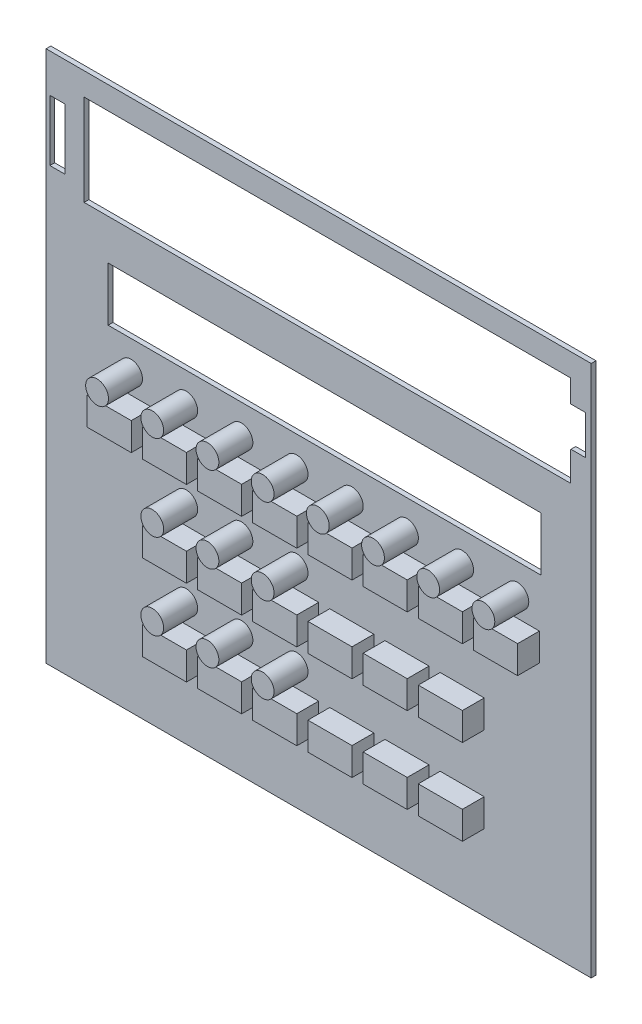
from build123d import *

# Parameters (mm, degrees)
SKETCH1_W                       = 182.118
SKETCH1_H                       = 177.8
SKETCH1_W_2                     = 144.56156
SKETCH1_H_2                     = 18.00098
SKETCH1_W_3                     = 5.08
SKETCH1_H_3                     = 20.32
BOARD_DEPTH                     = 1.592072
SKETCH2_R                       = 3.81
LED_KINGBRIGHT_3P_2P54_1_DEPTH  = 11.3538
SKETCH3_R                       = 3.81
LED_KINGBRIGHT_3P_2P54_2_DEPTH  = 11.3538
SKETCH4_R                       = 3.81
LED_KINGBRIGHT_3P_2P54_3_DEPTH  = 11.3538
SKETCH6_R                       = 3.81
LED_KINGBRIGHT_3P_2P54_5_DEPTH  = 11.3538
SKETCH7_R                       = 3.81
LED_KINGBRIGHT_3P_2P54_6_DEPTH  = 11.3538
SKETCH8_R                       = 3.81
LED_KINGBRIGHT_3P_2P54_7_DEPTH  = 11.3538
SKETCH10_R                      = 3.81
LED_KINGBRIGHT_3P_2P54_9_DEPTH  = 11.3538
SKETCH11_R                      = 3.81
LED_KINGBRIGHT_3P_2P54_10_DEPTH = 11.3538
SKETCH12_R                      = 3.81
LED_KINGBRIGHT_3P_2P54_11_DEPTH = 11.3538
SKETCH13_R                      = 3.81
LED_KINGBRIGHT_3P_2P54_12_DEPTH = 11.3538
SKETCH14_R                      = 3.81
LED_KINGBRIGHT_3P_2P54_13_DEPTH = 11.3538
SKETCH15_R                      = 3.81
LED_KINGBRIGHT_3P_2P54_14_DEPTH = 11.3538
SKETCH16_R                      = 3.81
LED_KINGBRIGHT_3P_2P54_15_DEPTH = 11.3538
SKETCH17_R                      = 3.81
LED_KINGBRIGHT_3P_2P54_16_DEPTH = 11.3538
SKETCH18_W                      = 14.732
SKETCH18_H                      = 9.271
SWITCH_MCDTS2_1_DEPTH           = 7.3000108
SKETCH19_W                      = 14.732
SKETCH19_H                      = 9.271
SWITCH_MCDTS2_2_DEPTH           = 7.3000108
SKETCH20_W                      = 14.732
SKETCH20_H                      = 9.271
SWITCH_MCDTS2_3_DEPTH           = 7.3000108
SKETCH21_W                      = 14.732
SKETCH21_H                      = 9.271
SWITCH_MCDTS2_4_DEPTH           = 7.3000108
SKETCH22_W                      = 14.732
SKETCH22_H                      = 9.271
SWITCH_MCDTS2_5_DEPTH           = 7.3000108
SKETCH23_W                      = 14.732
SKETCH23_H                      = 9.271
SWITCH_MCDTS2_6_DEPTH           = 7.3000108
SKETCH25_W                      = 14.732
SKETCH25_H                      = 9.271
SWITCH_MCDTS2_8_DEPTH           = 7.3000108
SKETCH26_W                      = 14.732
SKETCH26_H                      = 9.271
SWITCH_MCDTS2_9_DEPTH           = 7.3000108
SKETCH27_W                      = 14.732
SKETCH27_H                      = 9.271
SWITCH_MCDTS2_10_DEPTH          = 7.3000108
SKETCH28_W                      = 14.732
SKETCH28_H                      = 9.271
SWITCH_MCDTS2_11_DEPTH          = 7.3000108
SKETCH29_W                      = 14.732
SKETCH29_H                      = 9.271
SWITCH_MCDTS2_12_DEPTH          = 7.3000108
SKETCH30_W                      = 14.732
SKETCH30_H                      = 9.271
SWITCH_MCDTS2_13_DEPTH          = 7.3000108
SKETCH32_W                      = 14.732
SKETCH32_H                      = 9.271
SWITCH_MCDTS2_15_DEPTH          = 7.3000108
SKETCH33_W                      = 14.732
SKETCH33_H                      = 9.271
SWITCH_MCDTS2_16_DEPTH          = 7.3000108
SKETCH34_W                      = 14.732
SKETCH34_H                      = 9.271
SWITCH_MCDTS2_17_DEPTH          = 7.3000108
SKETCH35_W                      = 14.732
SKETCH35_H                      = 9.271
SWITCH_MCDTS2_18_DEPTH          = 7.3000108
SKETCH36_W                      = 14.732
SKETCH36_H                      = 9.271
SWITCH_MCDTS2_19_DEPTH          = 7.3000108
SKETCH37_W                      = 14.732
SKETCH37_H                      = 9.271
SWITCH_MCDTS2_20_DEPTH          = 7.3000108
SKETCH38_W                      = 14.732
SKETCH38_H                      = 9.271
SWITCH_MCDTS2_21_DEPTH          = 7.3000108
SKETCH39_W                      = 14.732
SKETCH39_H                      = 9.271
SWITCH_MCDTS2_22_DEPTH          = 7.3000108


with BuildPart() as part:
    # Sketch1 → BOARD (new body)
    with BuildSketch(Plane.XY):
        with Locations((91.059, 88.9)):
            Rectangle(SKETCH1_W, SKETCH1_H)
        with Locations((93.01988, 117.17909)):
            Rectangle(SKETCH1_W_2, SKETCH1_H_2, mode=Mode.SUBTRACT)
        with Locations((3.81, 154.813)):
            Rectangle(SKETCH1_W_3, SKETCH1_H_3, mode=Mode.SUBTRACT)
        Polygon((12.7, 139.7), (12.7, 170.18), (175.26, 170.18), (175.26, 162.6616), (180.086, 162.6616), (180.2892, 162.4584), (180.2892, 149.606), (175.3616, 149.606), (175.26, 149.5044), (175.26, 139.7), align=None, mode=Mode.SUBTRACT)
    extrude(amount=BOARD_DEPTH)


with BuildPart() as body_2:
    # Sketch2 → LED-KINGBRIGHT_3P_2P54-1 (new body)
    with BuildSketch(Plane.XY.offset(1.592072)):
        with Locations((83.7097132, 41.1988)):
            Circle(SKETCH2_R)
    extrude(amount=LED_KINGBRIGHT_3P_2P54_1_DEPTH)


with BuildPart() as body_3:
    # Sketch3 → LED-KINGBRIGHT_3P_2P54-2 (new body)
    with BuildSketch(Plane.XY.offset(1.592072)):
        with Locations((65.2722088, 41.1988)):
            Circle(SKETCH3_R)
    extrude(amount=LED_KINGBRIGHT_3P_2P54_2_DEPTH)


with BuildPart() as body_4:
    # Sketch4 → LED-KINGBRIGHT_3P_2P54-3 (new body)
    with BuildSketch(Plane.XY.offset(1.592072)):
        with Locations((46.8347044, 41.1988)):
            Circle(SKETCH4_R)
    extrude(amount=LED_KINGBRIGHT_3P_2P54_3_DEPTH)


with BuildPart() as body_5:
    # Sketch6 → LED-KINGBRIGHT_3P_2P54-5 (new body)
    with BuildSketch(Plane.XY.offset(1.592072)):
        with Locations((83.7097132, 69.7738)):
            Circle(SKETCH6_R)
    extrude(amount=LED_KINGBRIGHT_3P_2P54_5_DEPTH)


with BuildPart() as body_6:
    # Sketch7 → LED-KINGBRIGHT_3P_2P54-6 (new body)
    with BuildSketch(Plane.XY.offset(1.592072)):
        with Locations((65.2722088, 69.7738)):
            Circle(SKETCH7_R)
    extrude(amount=LED_KINGBRIGHT_3P_2P54_6_DEPTH)


with BuildPart() as body_7:
    # Sketch8 → LED-KINGBRIGHT_3P_2P54-7 (new body)
    with BuildSketch(Plane.XY.offset(1.592072)):
        with Locations((46.8347044, 69.7738)):
            Circle(SKETCH8_R)
    extrude(amount=LED_KINGBRIGHT_3P_2P54_7_DEPTH)


with BuildPart() as body_8:
    # Sketch10 → LED-KINGBRIGHT_3P_2P54-9 (new body)
    with BuildSketch(Plane.XY.offset(1.592072)):
        with Locations((157.4597308, 98.3488)):
            Circle(SKETCH10_R)
    extrude(amount=LED_KINGBRIGHT_3P_2P54_9_DEPTH)


with BuildPart() as body_9:
    # Sketch11 → LED-KINGBRIGHT_3P_2P54-10 (new body)
    with BuildSketch(Plane.XY.offset(1.592072)):
        with Locations((139.0222264, 98.3488)):
            Circle(SKETCH11_R)
    extrude(amount=LED_KINGBRIGHT_3P_2P54_10_DEPTH)


with BuildPart() as body_10:
    # Sketch12 → LED-KINGBRIGHT_3P_2P54-11 (new body)
    with BuildSketch(Plane.XY.offset(1.592072)):
        with Locations((120.584722, 98.3488)):
            Circle(SKETCH12_R)
    extrude(amount=LED_KINGBRIGHT_3P_2P54_11_DEPTH)


with BuildPart() as body_11:
    # Sketch13 → LED-KINGBRIGHT_3P_2P54-12 (new body)
    with BuildSketch(Plane.XY.offset(1.592072)):
        with Locations((102.1472176, 98.3488)):
            Circle(SKETCH13_R)
    extrude(amount=LED_KINGBRIGHT_3P_2P54_12_DEPTH)


with BuildPart() as body_12:
    # Sketch14 → LED-KINGBRIGHT_3P_2P54-13 (new body)
    with BuildSketch(Plane.XY.offset(1.592072)):
        with Locations((83.7097132, 98.3488)):
            Circle(SKETCH14_R)
    extrude(amount=LED_KINGBRIGHT_3P_2P54_13_DEPTH)


with BuildPart() as body_13:
    # Sketch15 → LED-KINGBRIGHT_3P_2P54-14 (new body)
    with BuildSketch(Plane.XY.offset(1.592072)):
        with Locations((65.2722088, 98.3488)):
            Circle(SKETCH15_R)
    extrude(amount=LED_KINGBRIGHT_3P_2P54_14_DEPTH)


with BuildPart() as body_14:
    # Sketch16 → LED-KINGBRIGHT_3P_2P54-15 (new body)
    with BuildSketch(Plane.XY.offset(1.592072)):
        with Locations((46.8347044, 98.3488)):
            Circle(SKETCH16_R)
    extrude(amount=LED_KINGBRIGHT_3P_2P54_15_DEPTH)


with BuildPart() as body_15:
    # Sketch17 → LED-KINGBRIGHT_3P_2P54-16 (new body)
    with BuildSketch(Plane.XY.offset(1.592072)):
        with Locations((28.3972, 98.3488)):
            Circle(SKETCH17_R)
    extrude(amount=LED_KINGBRIGHT_3P_2P54_16_DEPTH)


with BuildPart() as body_16:
    # Sketch18 → SWITCH-MCDTS2-1 (new body)
    with BuildSketch(Plane.XY.offset(1.592072)):
        with Locations((139.0222264, 29.9593)):
            Rectangle(SKETCH18_W, SKETCH18_H)
    extrude(amount=SWITCH_MCDTS2_1_DEPTH)


with BuildPart() as body_17:
    # Sketch19 → SWITCH-MCDTS2-2 (new body)
    with BuildSketch(Plane.XY.offset(1.592072)):
        with Locations((120.584722, 29.9593)):
            Rectangle(SKETCH19_W, SKETCH19_H)
    extrude(amount=SWITCH_MCDTS2_2_DEPTH)


with BuildPart() as body_18:
    # Sketch20 → SWITCH-MCDTS2-3 (new body)
    with BuildSketch(Plane.XY.offset(1.592072)):
        with Locations((102.1472176, 29.9593)):
            Rectangle(SKETCH20_W, SKETCH20_H)
    extrude(amount=SWITCH_MCDTS2_3_DEPTH)


with BuildPart() as body_19:
    # Sketch21 → SWITCH-MCDTS2-4 (new body)
    with BuildSketch(Plane.XY.offset(1.592072)):
        with Locations((83.7097132, 29.9593)):
            Rectangle(SKETCH21_W, SKETCH21_H)
    extrude(amount=SWITCH_MCDTS2_4_DEPTH)


with BuildPart() as body_20:
    # Sketch22 → SWITCH-MCDTS2-5 (new body)
    with BuildSketch(Plane.XY.offset(1.592072)):
        with Locations((65.2722088, 29.9593)):
            Rectangle(SKETCH22_W, SKETCH22_H)
    extrude(amount=SWITCH_MCDTS2_5_DEPTH)


with BuildPart() as body_21:
    # Sketch23 → SWITCH-MCDTS2-6 (new body)
    with BuildSketch(Plane.XY.offset(1.592072)):
        with Locations((46.8347044, 29.9593)):
            Rectangle(SKETCH23_W, SKETCH23_H)
    extrude(amount=SWITCH_MCDTS2_6_DEPTH)


with BuildPart() as body_22:
    # Sketch25 → SWITCH-MCDTS2-8 (new body)
    with BuildSketch(Plane.XY.offset(1.592072)):
        with Locations((139.0222264, 58.5343)):
            Rectangle(SKETCH25_W, SKETCH25_H)
    extrude(amount=SWITCH_MCDTS2_8_DEPTH)


with BuildPart() as body_23:
    # Sketch26 → SWITCH-MCDTS2-9 (new body)
    with BuildSketch(Plane.XY.offset(1.592072)):
        with Locations((120.584722, 58.5343)):
            Rectangle(SKETCH26_W, SKETCH26_H)
    extrude(amount=SWITCH_MCDTS2_9_DEPTH)


with BuildPart() as body_24:
    # Sketch27 → SWITCH-MCDTS2-10 (new body)
    with BuildSketch(Plane.XY.offset(1.592072)):
        with Locations((102.1472176, 58.5343)):
            Rectangle(SKETCH27_W, SKETCH27_H)
    extrude(amount=SWITCH_MCDTS2_10_DEPTH)


with BuildPart() as body_25:
    # Sketch28 → SWITCH-MCDTS2-11 (new body)
    with BuildSketch(Plane.XY.offset(1.592072)):
        with Locations((83.7097132, 58.5343)):
            Rectangle(SKETCH28_W, SKETCH28_H)
    extrude(amount=SWITCH_MCDTS2_11_DEPTH)


with BuildPart() as body_26:
    # Sketch29 → SWITCH-MCDTS2-12 (new body)
    with BuildSketch(Plane.XY.offset(1.592072)):
        with Locations((65.2722088, 58.5343)):
            Rectangle(SKETCH29_W, SKETCH29_H)
    extrude(amount=SWITCH_MCDTS2_12_DEPTH)


with BuildPart() as body_27:
    # Sketch30 → SWITCH-MCDTS2-13 (new body)
    with BuildSketch(Plane.XY.offset(1.592072)):
        with Locations((46.8347044, 58.5343)):
            Rectangle(SKETCH30_W, SKETCH30_H)
    extrude(amount=SWITCH_MCDTS2_13_DEPTH)


with BuildPart() as body_28:
    # Sketch32 → SWITCH-MCDTS2-15 (new body)
    with BuildSketch(Plane.XY.offset(1.592072)):
        with Locations((157.4597308, 87.1093)):
            Rectangle(SKETCH32_W, SKETCH32_H)
    extrude(amount=SWITCH_MCDTS2_15_DEPTH)


with BuildPart() as body_29:
    # Sketch33 → SWITCH-MCDTS2-16 (new body)
    with BuildSketch(Plane.XY.offset(1.592072)):
        with Locations((139.0222264, 87.1093)):
            Rectangle(SKETCH33_W, SKETCH33_H)
    extrude(amount=SWITCH_MCDTS2_16_DEPTH)


with BuildPart() as body_30:
    # Sketch34 → SWITCH-MCDTS2-17 (new body)
    with BuildSketch(Plane.XY.offset(1.592072)):
        with Locations((120.584722, 87.1093)):
            Rectangle(SKETCH34_W, SKETCH34_H)
    extrude(amount=SWITCH_MCDTS2_17_DEPTH)


with BuildPart() as body_31:
    # Sketch35 → SWITCH-MCDTS2-18 (new body)
    with BuildSketch(Plane.XY.offset(1.592072)):
        with Locations((102.1472176, 87.1093)):
            Rectangle(SKETCH35_W, SKETCH35_H)
    extrude(amount=SWITCH_MCDTS2_18_DEPTH)


with BuildPart() as body_32:
    # Sketch36 → SWITCH-MCDTS2-19 (new body)
    with BuildSketch(Plane.XY.offset(1.592072)):
        with Locations((83.7097132, 87.1093)):
            Rectangle(SKETCH36_W, SKETCH36_H)
    extrude(amount=SWITCH_MCDTS2_19_DEPTH)


with BuildPart() as body_33:
    # Sketch37 → SWITCH-MCDTS2-20 (new body)
    with BuildSketch(Plane.XY.offset(1.592072)):
        with Locations((65.2722088, 87.1093)):
            Rectangle(SKETCH37_W, SKETCH37_H)
    extrude(amount=SWITCH_MCDTS2_20_DEPTH)


with BuildPart() as body_34:
    # Sketch38 → SWITCH-MCDTS2-21 (new body)
    with BuildSketch(Plane.XY.offset(1.592072)):
        with Locations((46.8347044, 87.1093)):
            Rectangle(SKETCH38_W, SKETCH38_H)
    extrude(amount=SWITCH_MCDTS2_21_DEPTH)


with BuildPart() as body_35:
    # Sketch39 → SWITCH-MCDTS2-22 (new body)
    with BuildSketch(Plane.XY.offset(1.592072)):
        with Locations((28.3972, 87.1093)):
            Rectangle(SKETCH39_W, SKETCH39_H)
    extrude(amount=SWITCH_MCDTS2_22_DEPTH)


solid = Compound([part.part, body_2.part, body_3.part, body_4.part, body_5.part, body_6.part, body_7.part, body_8.part, body_9.part, body_10.part, body_11.part, body_12.part, body_13.part, body_14.part, body_15.part, body_16.part, body_17.part, body_18.part, body_19.part, body_20.part, body_21.part, body_22.part, body_23.part, body_24.part, body_25.part, body_26.part, body_27.part, body_28.part, body_29.part, body_30.part, body_31.part, body_32.part, body_33.part, body_34.part, body_35.part])
